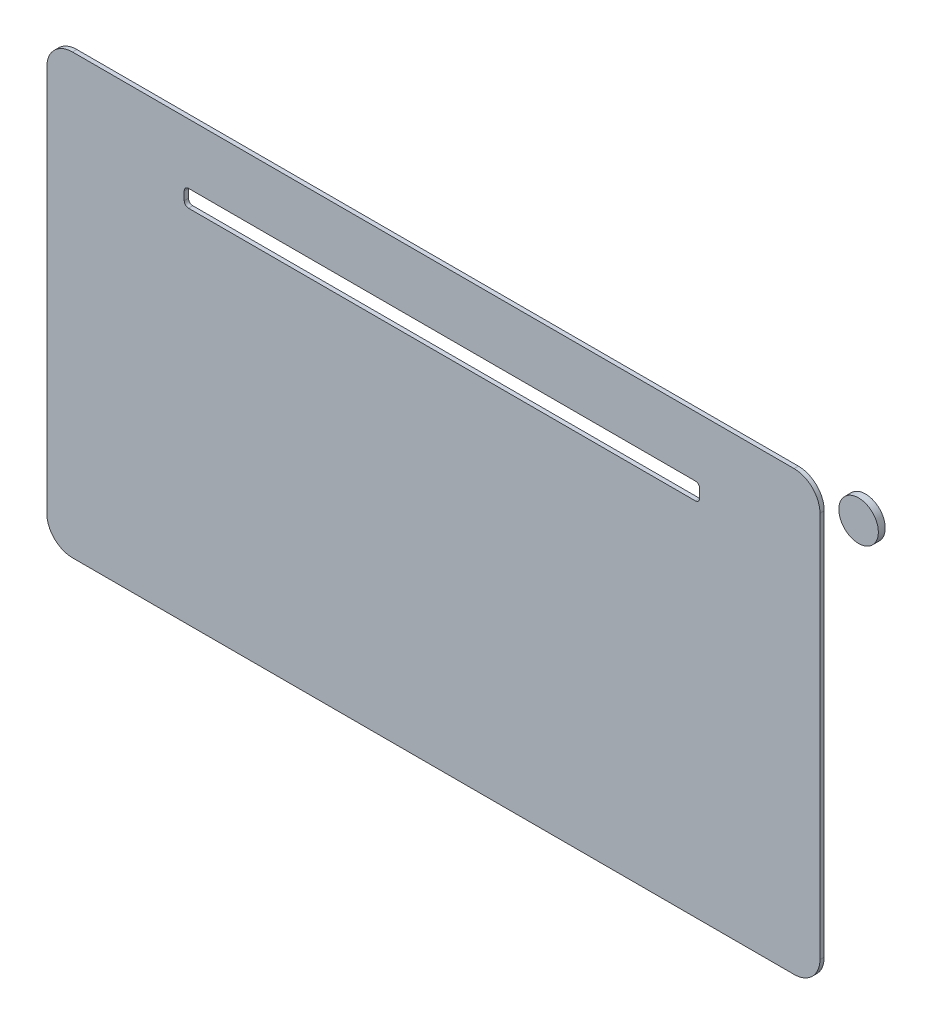
from build123d import *

# Parameters (mm, degrees)
PRINTER_ACCESS_DOOR_OUTSIDE_CASE_START    = -0.5
PRINTER_ACCESS_DOOR_OUTSIDE_CASE_DEPTH    = 0.5
PRINTER_FEED_BUTTON_START                 = -0.8
SKETCH_2_R                                = 2.3
PRINTER_FEED_BUTTON_DEPTH                 = 0.8
VISIBLE_PAPER_OUTPUT_SLOT_REFERENCE_DEPTH = 1


with BuildPart() as part:
    # 草图1 → Printer_access_door_outside_case (new body)
    with BuildSketch(Plane.XY.offset(PRINTER_ACCESS_DOOR_OUTSIDE_CASE_START)):
        with BuildLine():
            Line((41, 12), (125, 12))
            ThreePointArc((125, 12), (127.121320344, 12.878679656), (128, 15))
            Line((128, 15), (128, 60))
            ThreePointArc((128, 60), (127.121320344, 62.121320344), (125, 63))
            Line((125, 63), (41, 63))
            ThreePointArc((41, 63), (38.878679656, 62.121320344), (38, 60))
            Line((38, 60), (38, 15))
            ThreePointArc((38, 15), (38.878679656, 12.878679656), (41, 12))
        make_face()
    extrude(amount=PRINTER_ACCESS_DOOR_OUTSIDE_CASE_DEPTH)

    # 草图3 → Visible_paper_output_slot_REFERENCE (cut)
    with BuildSketch(Plane(origin=(0, 0, -0.5), x_dir=(-1, 0, 0), z_dir=(0, 0, -1))):
        with BuildLine():
            Line((-113.5, 54), (-54.5, 54))
            ThreePointArc((-54.5, 54), (-54.146446609, 54.146446609), (-54, 54.5))
            Line((-54, 54.5), (-54, 55.5))
            ThreePointArc((-54, 55.5), (-54.146446609, 55.853553391), (-54.5, 56))
            Line((-54.5, 56), (-113.5, 56))
            ThreePointArc((-113.5, 56), (-113.853553391, 55.853553391), (-114, 55.5))
            Line((-114, 55.5), (-114, 54.5))
            ThreePointArc((-114, 54.5), (-113.853553391, 54.146446609), (-113.5, 54))
        make_face()
    extrude(amount=-VISIBLE_PAPER_OUTPUT_SLOT_REFERENCE_DEPTH, mode=Mode.SUBTRACT)


with BuildPart() as body_2:
    # 草图2 → Printer_feed_button (new body)
    with BuildSketch(Plane.XY.offset(PRINTER_FEED_BUTTON_START)):
        with Locations((132.5, 61.5)):
            Circle(SKETCH_2_R)
    extrude(amount=PRINTER_FEED_BUTTON_DEPTH)


solid = Compound([part.part, body_2.part])
